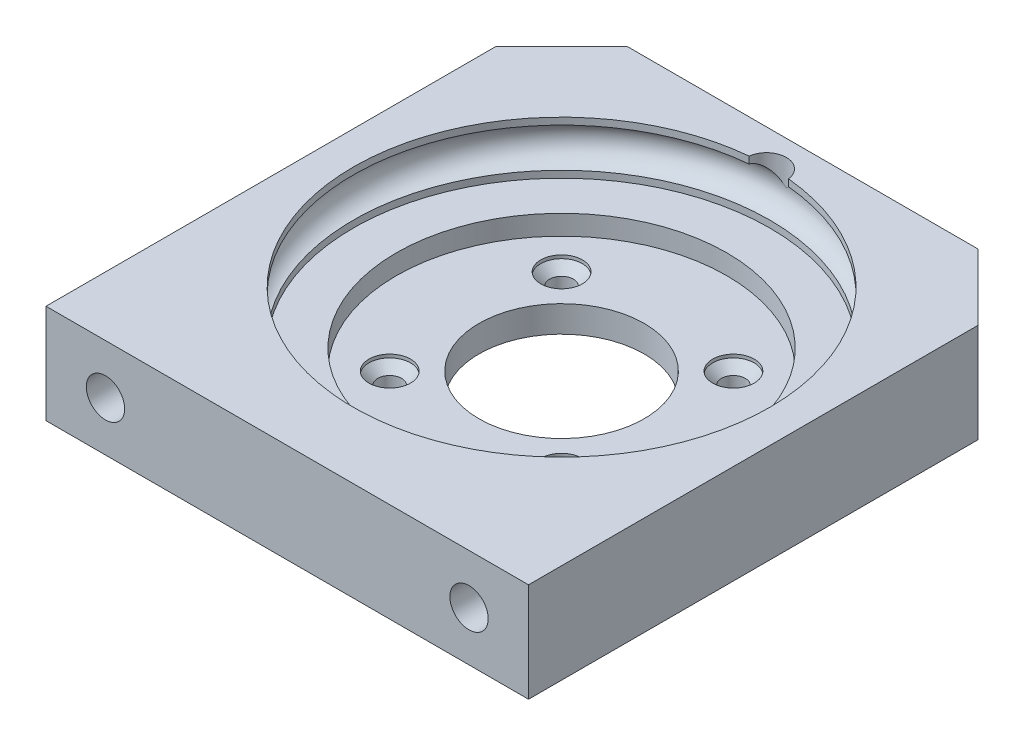
from build123d import *

# Parameters (mm, degrees)
SKETCH3_R                                    = 1.25
CUT_EXTRUDE1_DEPTH                           = 53.777836257
SKETCH5_R                                    = 3
SKETCH6_R                                    = 3
CUT_EXTRUDE2_DEPTH                           = 10
BOSS_EXTRUDE1_DEPTH                          = 15
SKETCH9_R                                    = 2.9
CUT_EXTRUDE3_DEPTH                           = 6.5
CSK_FOR_M3_COUNTERSUNK_FLAT_HEAD_SCR_2_COUNT = 2
CSK_FOR_M3_COUNTERSUNK_FLAT_HEAD_SCR_2_PITCH = 26
CSK_FOR_M3_COUNTERSUNK_FLAT_HEAD_SCR_3_COUNT = 2
CSK_FOR_M3_COUNTERSUNK_FLAT_HEAD_SCR_3_PITCH = 36.769552622
CSK_FOR_M3_COUNTERSUNK_FLAT_HEAD_SCR_4_COUNT = 2
CSK_FOR_M3_COUNTERSUNK_FLAT_HEAD_SCR_4_PITCH = 26
BOSS_EXTRUDE2_DEPTH                          = 15


with BuildPart() as part:
    # Sketch2 → Revolve1 (revolve)
    with BuildSketch(Plane.XY, mode=Mode.PRIVATE) as revolve1_sk:
        Polygon((-25, 3), (-25, 0), (-12.5, 0), (-12.5, -4), (-36.5, -4), (-36.5, 11), (-31.5, 11), (-31.5, 3), align=None)
    revolve(revolve1_sk.sketch.rotate(Axis((0, 0, 0), (0, 1, 0)), 270), axis=Axis((0, 0, 0), (0, 1, 0)))

    # Sketch3 → Cut-Extrude1 (cut, through all)
    with BuildSketch(Plane(origin=(0, 0, 0), x_dir=(1, 0, 0), z_dir=(0, 1, 0))):
        with Locations(Location((-13, 13, 0), (0, 0, 270))):
            Circle(SKETCH3_R)
        with Locations(Location((13, 13, 0), (0, 0, 270))):
            Circle(SKETCH3_R)
        with Locations(Location((13, -13, 0), (0, 0, 270))):
            Circle(SKETCH3_R)
        with Locations(Location((-13, -13, 0), (0, 0, 270))):
            Circle(SKETCH3_R)
    extrude(amount=-CUT_EXTRUDE1_DEPTH, mode=Mode.SUBTRACT)

    # Sketch5 → Cut-Revolve1 (revolve, cut)
    with BuildSketch(Plane.XY, mode=Mode.PRIVATE) as cut_revolve1_sk:
        with Locations((31, 7)):
            Circle(SKETCH5_R)
    revolve(cut_revolve1_sk.sketch.rotate(Axis((0, 0, 0), (0, -1, 0)), 270), axis=Axis((0, 0, 0), (0, -1, 0)), mode=Mode.SUBTRACT)

    # Sketch6 → Cut-Extrude2 (cut)
    with BuildSketch(Plane(origin=(0, 7, 0), x_dir=(1, 0, 0), z_dir=(0, 1, 0))):
        with Locations((0, 31)):
            Circle(SKETCH6_R)
    extrude(amount=CUT_EXTRUDE2_DEPTH, mode=Mode.SUBTRACT)

    # Sketch7 → Boss-Extrude1 (add)
    with BuildSketch(Plane(origin=(0, 11, 0), x_dir=(1, 0, 0), z_dir=(0, 1, 0))):
        with BuildLine():
            Line((-36.5, 0), (-36.5, -41.5))
            Line((-36.5, -41.5), (36.5, -41.5))
            Line((36.5, -41.5), (36.5, 0))
            ThreePointArc((36.5, 0), (0, -36.5), (-36.5, 0))
        make_face()
    extrude(amount=-BOSS_EXTRUDE1_DEPTH)

    # Sketch9 → Cut-Extrude3 (cut)
    with BuildSketch(Plane.XY.offset(41.5)):
        with Locations((-27.5, 3.5)):
            Circle(SKETCH9_R)
        with Locations((27.5, 3.5)):
            Circle(SKETCH9_R)
    extrude(amount=-CUT_EXTRUDE3_DEPTH, mode=Mode.SUBTRACT)

    # Sketch11 → CSK for M3 Countersunk Flat Head Screw1 (revolve, cut)
    with BuildSketch(Plane(origin=(13, 0, -13), x_dir=(0, 0, 1), z_dir=(1, 0, 0))):
        Polygon((0, 0), (0, 4), (1.8, 4), (1.8, 1.85), (3.15, 0.5), (3.15, 0), align=None)
    csk_for_m3_countersunk_flat_head_screw1 = revolve(axis=Axis((13, 6.35, -13), (0, -1, 0)), mode=Mode.SUBTRACT)

    # CSK for M3 Countersunk Flat Head Scr 2: CSK for M3 Countersunk Flat Head Screw1 ×2
    with Locations(*[(0, 0, i * CSK_FOR_M3_COUNTERSUNK_FLAT_HEAD_SCR_2_PITCH) for i in range(1, CSK_FOR_M3_COUNTERSUNK_FLAT_HEAD_SCR_2_COUNT)]):
        add(csk_for_m3_countersunk_flat_head_screw1, mode=Mode.SUBTRACT)

    # CSK for M3 Countersunk Flat Head Scr 3: CSK for M3 Countersunk Flat Head Screw1 ×2
    with Locations(*[Vector(-0.7071067811865476, 0, 0.7071067811865476) * (i * CSK_FOR_M3_COUNTERSUNK_FLAT_HEAD_SCR_3_PITCH) for i in range(1, CSK_FOR_M3_COUNTERSUNK_FLAT_HEAD_SCR_3_COUNT)]):
        add(csk_for_m3_countersunk_flat_head_screw1, mode=Mode.SUBTRACT)

    # CSK for M3 Countersunk Flat Head Scr 4: CSK for M3 Countersunk Flat Head Screw1 ×2
    with Locations(*[(-i * CSK_FOR_M3_COUNTERSUNK_FLAT_HEAD_SCR_4_PITCH, 0, 0) for i in range(1, CSK_FOR_M3_COUNTERSUNK_FLAT_HEAD_SCR_4_COUNT)]):
        add(csk_for_m3_countersunk_flat_head_screw1, mode=Mode.SUBTRACT)

    # Sketch12 → Boss-Extrude2 (add)
    with BuildSketch(Plane(origin=(0, 11, 0), x_dir=(1, 0, 0), z_dir=(0, 1, 0))):
        with BuildLine():
            Line((26.5, 36.5), (0, 36.5))
            ThreePointArc((0, 36.5), (25.809397513, 25.809397513), (36.5, 0))
            Line((36.5, 0), (36.5, 26.5))
            Line((36.5, 26.5), (26.5, 36.5))
        make_face()
        with BuildLine():
            Line((-36.5, 26.5), (-36.5, 0))
            ThreePointArc((-36.5, 0), (-25.809397513, 25.809397513), (0, 36.5))
            Line((0, 36.5), (-26.5, 36.5))
            Line((-26.5, 36.5), (-36.5, 26.5))
        make_face()
    extrude(amount=-BOSS_EXTRUDE2_DEPTH)


solid = part.part
